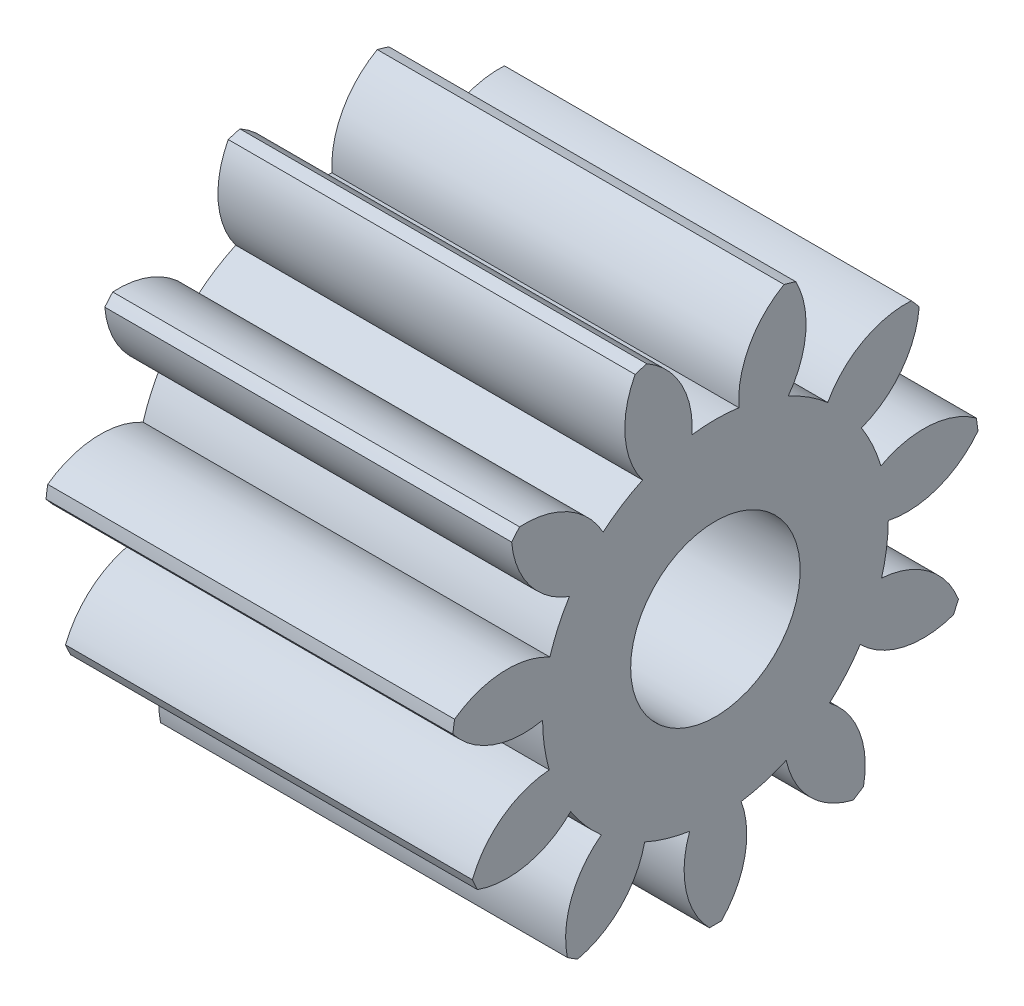
from build123d import *

# Parameters (mm, degrees)
BASPROSKE_W     = 6
BASPROSKE_H     = 3.9
TOOTHCUT_DEPTH  = 9.149846624
TEETHCUTS_COUNT = 11
BORSKE_R        = 1.25
BORE_DEPTH      = 50.0001524


with BuildPart() as part:
    # BasProSke → Base-Revolve (revolve)
    with BuildSketch(Plane(origin=(0, 0, 0), x_dir=(1, 0, 0), z_dir=(0, 1, 0)), mode=Mode.PRIVATE) as base_revolve_sk:
        with Locations((3, 1.95)):
            Rectangle(BASPROSKE_W, BASPROSKE_H)
    revolve(base_revolve_sk.sketch.rotate(Axis((-10, 0, 0), (1, 0, 0)), 180), axis=Axis((-10, 0, 0), (1, 0, 0)))

    # TooCutSke → ToothCut (cut, through all)
    with BuildSketch(Plane(origin=(0, 0, 0), x_dir=(0, 0, -1), z_dir=(1, 0, 0))):
        with BuildLine():
            ThreePointArc((0.345926135, 2.525418007), (0, 2.549), (-0.345926135, 2.525418007))
            ThreePointArc((-0.345926135, 2.525418007), (-0.508630204, 3.258246769), (-1.044575138, 3.783864155))
            ThreePointArc((-1.044575138, 3.783864155), (0, 3.9254), (1.044575138, 3.783864155))
            ThreePointArc((1.044575138, 3.783864155), (0.508630204, 3.258246769), (0.345926135, 2.525418007))
        make_face()
    toothcut = extrude(amount=TOOTHCUT_DEPTH, mode=Mode.SUBTRACT)

    # TeethCuts: ToothCut ×11 about axis
    teethcuts_axis = Axis((0, 0, 0), (1, 0, 0))
    for i in range(1, TEETHCUTS_COUNT):
        add(toothcut.rotate(teethcuts_axis, i * 360 / TEETHCUTS_COUNT), mode=Mode.SUBTRACT)

    # BorSke → Bore (cut, symmetric)
    with BuildSketch(Plane(origin=(0, 0, 0), x_dir=(0, 0, -1), z_dir=(1, 0, 0))):
        with Locations(Location((0, 0, 0), (0, 0, 180))):
            Circle(BORSKE_R)
    extrude(amount=BORE_DEPTH, both=True, mode=Mode.SUBTRACT)


solid = part.part
